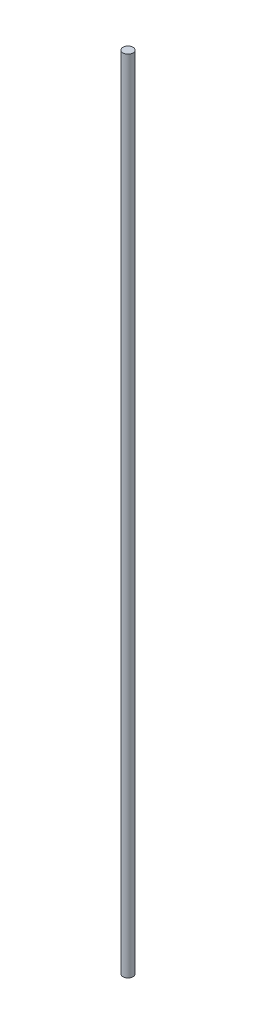
from build123d import *

# Parameters (mm, degrees)
BOSS_EXTRUDE2_DEPTH      = 160
BOSS_EXTRUDE2_DEPTH_BACK = 160
SKETCH1_R                = 2


with BuildPart() as part:
    # Sketch1 → Boss-Extrude2 (new, two sides: drawn at the far end of the back side and taken through both)
    with BuildSketch(Plane(origin=(0, 0, 0), x_dir=(1, 0, 0), z_dir=(0, 1, 0)).offset(-BOSS_EXTRUDE2_DEPTH_BACK)):
        Circle(SKETCH1_R)
    extrude(amount=BOSS_EXTRUDE2_DEPTH + BOSS_EXTRUDE2_DEPTH_BACK)


solid = part.part
